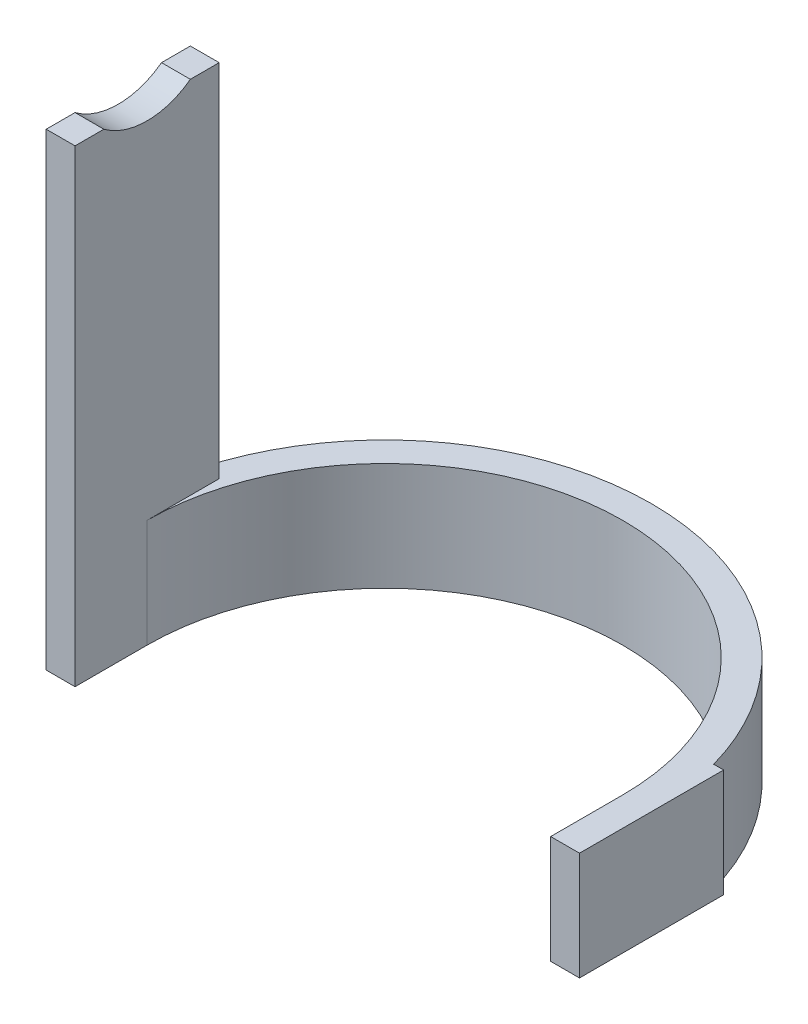
from build123d import *

# Parameters (mm, degrees)
EXTRUDE_1_DEPTH     = 30
SKETCH_2_W          = 8
SKETCH_2_H          = 40
EXTRUDE_2_DEPTH     = 100
SKETCH_3_R          = 20
CUT_EXTRUDE_1_DEPTH = 211.428135001
SKETCH_5_W          = 87.00766185
SKETCH_5_H          = 105.192301749
CUT_EXTRUDE_2_DEPTH = 10


with BuildPart() as part:
    # 草图1 → 凸台-拉伸1 (new body)
    with BuildSketch(Plane(origin=(0, 0, 0), x_dir=(1, 0, 0), z_dir=(0, 1, 0))):
        with BuildLine():
            Line((-74, 20), (-71.246052522, 20))
            ThreePointArc((-71.246052522, 20), (0, 74), (71.246052522, 20))
            Line((71.246052522, 20), (74, 20))
            Line((74, 20), (74, -20))
            Line((74, -20), (66, -20))
            Line((66, -20), (66, 0))
            ThreePointArc((66, 0), (0, 66), (-66, 0))
            Line((-66, 0), (-66, -20))
            Line((-66, -20), (-74, -20))
            Line((-74, -20), (-74, 20))
        make_face()
    extrude(amount=EXTRUDE_1_DEPTH)

    # 草图2 → 凸台-拉伸2 (add)
    with BuildSketch(Plane(origin=(0, 30, 0), x_dir=(1, 0, 0), z_dir=(0, 1, 0))):
        with Locations((-70, 0)):
            Rectangle(SKETCH_2_W, SKETCH_2_H)
        with Locations((70, 0)):
            Rectangle(SKETCH_2_W, SKETCH_2_H)
    extrude(amount=EXTRUDE_2_DEPTH)

    # 草图3 → 切除-拉伸1 (cut, through all)
    with BuildSketch(Plane.ZY.offset(74)):
        with Locations((0, 146)):
            Circle(SKETCH_3_R)
    extrude(amount=-CUT_EXTRUDE_1_DEPTH, mode=Mode.SUBTRACT)

    # 草图5 → 切除-拉伸2 (cut)
    with BuildSketch(Plane(origin=(74, 0, 0), x_dir=(0, 0, -1), z_dir=(1, 0, 0))):
        with Locations((-23.503830925, 82.596150874)):
            Rectangle(SKETCH_5_W, SKETCH_5_H)
    extrude(amount=-CUT_EXTRUDE_2_DEPTH, mode=Mode.SUBTRACT)


solid = part.part
